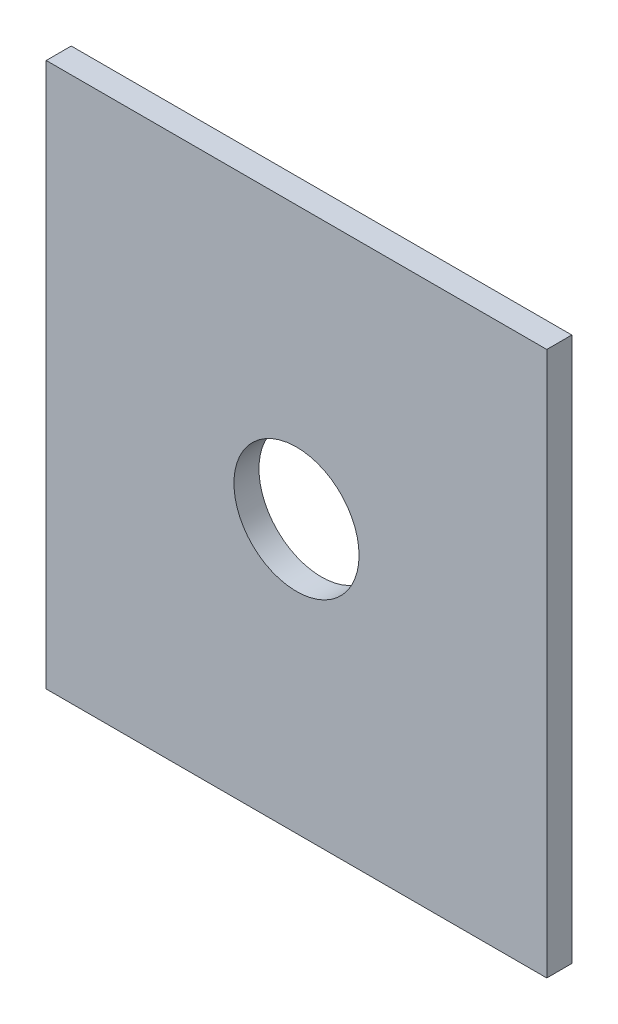
from build123d import *

# Parameters (mm, degrees)
SKETCH_2_W          = 40
SKETCH_2_H          = 43.5
EXTRUDE_1_DEPTH     = 2
SKETCH_3_R          = 5
CUT_EXTRUDE_1_DEPTH = 60.129096053


with BuildPart() as part:
    # 草图2 → 凸台-拉伸1 (new body)
    with BuildSketch(Plane.XY):
        with Locations((20, -21.75)):
            Rectangle(SKETCH_2_W, SKETCH_2_H)
    extrude(amount=EXTRUDE_1_DEPTH)

    # 草图3 → 切除-拉伸1 (cut, through all)
    with BuildSketch(Plane.XY.offset(2)):
        with Locations((20, -21.75)):
            Circle(SKETCH_3_R)
    extrude(amount=-CUT_EXTRUDE_1_DEPTH, mode=Mode.SUBTRACT)


solid = part.part
